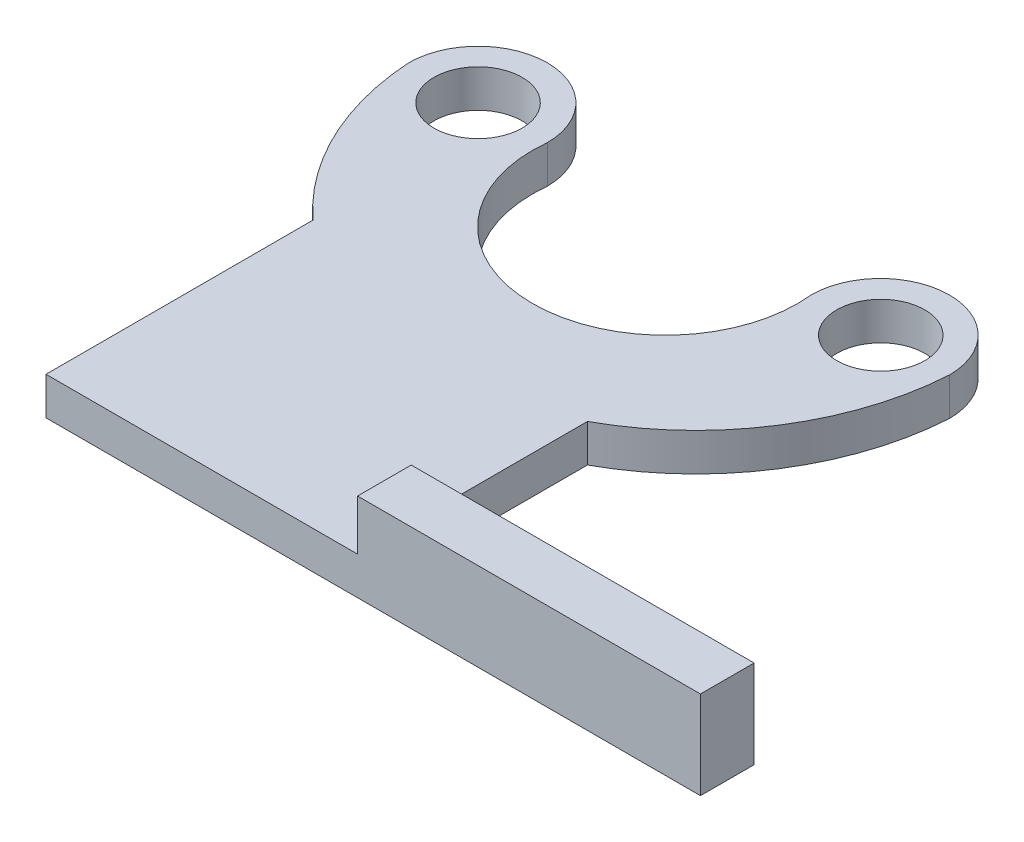
from build123d import *

# Parameters (mm, degrees)
SKETCH_1_R      = 1.75
EXTRUDE_1_DEPTH = 1.5
SKETCH_2_W      = 13.622112507
SKETCH_2_H      = 2.131934571
EXTRUDE_2_DEPTH = 2


with BuildPart() as part:
    # 草图1 → 凸台-拉伸1 (new body)
    with BuildSketch(Plane(origin=(0, 0, 0), x_dir=(1, 0, 0), z_dir=(0, 1, 0))):
        with BuildLine():
            Line((-7.23910046, -7.314129875), (-7.23910046, -17.924733935))
            Line((-7.23910046, -17.924733935), (18.76089954, -17.924733935))
            Line((18.76089954, -17.924733935), (18.76089954, -15.792799364))
            Line((18.76089954, -15.792799364), (5.138787033, -15.792799364))
            Line((5.138787033, -15.792799364), (5.138787033, -8.792799364))
            ThreePointArc((5.138787033, -8.792799364), (9.069997492, -5.118417293), (10.730510575, 0))
            ThreePointArc((10.730510575, 0), (7.980510575, 2.75), (5.230510575, 0))
            ThreePointArc((5.230510575, 0), (-0.009744712, -5.827408606), (-5.25, 0))
            ThreePointArc((-5.25, 0), (-8, 2.75), (-10.75, 0))
            ThreePointArc((-10.75, 0), (-9.710304188, -4.000638307), (-7.23910046, -7.314129875))
        make_face()
        with Locations(Location((-8, 0, 0), (0, 0, 270))):
            Circle(SKETCH_1_R, mode=Mode.SUBTRACT)
        with Locations(Location((8, 0, 0), (0, 0, 270))):
            Circle(SKETCH_1_R, mode=Mode.SUBTRACT)
    extrude(amount=EXTRUDE_1_DEPTH)

    # 草图2 → 凸台-拉伸2 (add)
    with BuildSketch(Plane(origin=(0, 1.5, 0), x_dir=(1, 0, 0), z_dir=(0, 1, 0))):
        with Locations((11.949843287, -16.85876665)):
            Rectangle(SKETCH_2_W, SKETCH_2_H)
    extrude(amount=EXTRUDE_2_DEPTH)


solid = part.part
